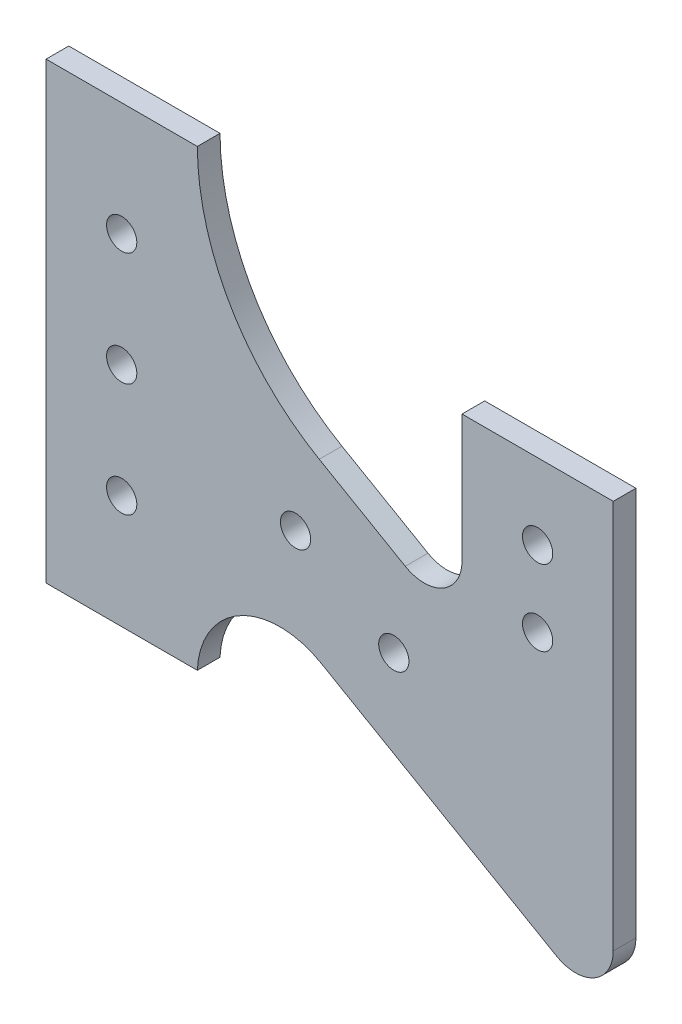
from build123d import *

# Parameters (mm, degrees)
SKETCH_1_R      = 2
EXTRUDE_1_DEPTH = 3


with BuildPart() as part:
    # 草图1 → 凸台-拉伸1 (new body)
    with BuildSketch(Plane.XY):
        with BuildLine():
            Line((-8.253871793, -13.107166096), (22.860072418, -31.070810161))
            ThreePointArc((22.860072418, -31.070810161), (27.860072418, -31.070810161), (30.360072418, -26.740683142))
            Line((30.360072418, -26.740683142), (30.360072418, 24.757413889))
            Line((30.360072418, 24.757413889), (10.360072418, 24.757413889))
            Line((10.360072418, 24.757413889), (10.360072418, 7.900333009))
            ThreePointArc((10.360072418, 7.900333009), (7.860072418, 3.57020599), (2.860072418, 3.57020599))
            Line((2.860072418, 3.57020599), (-8.514722631, 10.137446974))
            ThreePointArc((-8.514722631, 10.137446974), (-20.277530658, 21.869741204), (-24.639927582, 37.900333009))
            Line((-24.639927582, 37.900333009), (-44.639927582, 37.900333009))
            Line((-44.639927582, 37.900333009), (-44.639927582, -22.099666991))
            Line((-44.639927582, -22.099666991), (-24.639927582, -22.099666991))
            ThreePointArc((-24.639927582, -22.099666991), (-18.978211718, -12.990882096), (-8.253871793, -13.107166096))
        make_face()
        with Locations((-34.639927582, 22.900333009)):
            Circle(SKETCH_1_R, mode=Mode.SUBTRACT)
        with Locations((-34.639927582, 7.900333009)):
            Circle(SKETCH_1_R, mode=Mode.SUBTRACT)
        with Locations((-34.639927582, -7.099666991)):
            Circle(SKETCH_1_R, mode=Mode.SUBTRACT)
        with Locations((-11.649546525, 0.400333009)):
            Circle(SKETCH_1_R, mode=Mode.SUBTRACT)
        with Locations((1.340834531, -7.099666991)):
            Circle(SKETCH_1_R, mode=Mode.SUBTRACT)
        with Locations((20.360072418, 4.757413889)):
            Circle(SKETCH_1_R, mode=Mode.SUBTRACT)
        with Locations((20.360072418, 14.757413889)):
            Circle(SKETCH_1_R, mode=Mode.SUBTRACT)
    extrude(amount=EXTRUDE_1_DEPTH)


solid = part.part
